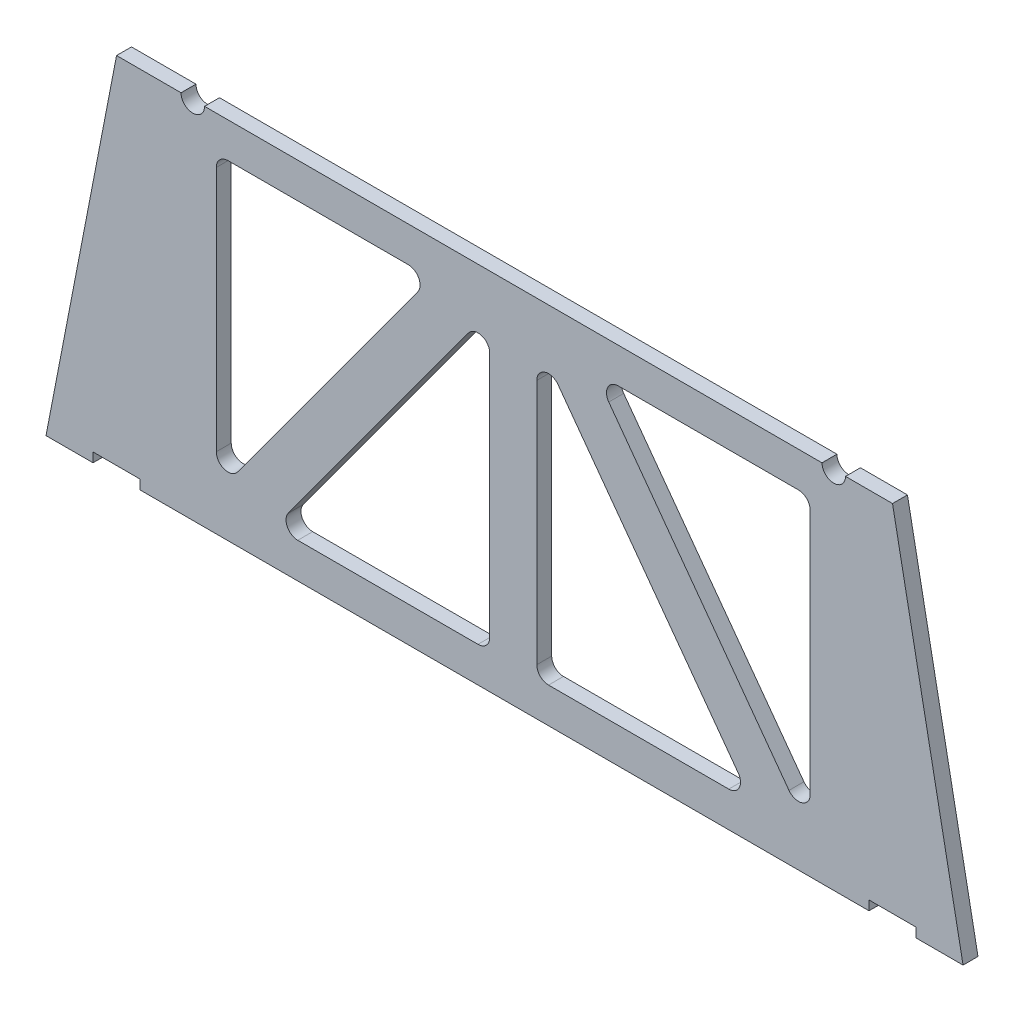
from build123d import *

# Parameters (mm, degrees)
EXTRUDE1_DEPTH = 6.35


with BuildPart() as part:
    # Sketch1 → Extrude1 (new body)
    with BuildSketch(Plane.XY):
        with BuildLine():
            Line((-158.7125, -77.5), (151.2875, -77.5))
            Line((151.2875, -77.5), (151.2875, -73.5))
            Line((151.2875, -73.5), (171.2875, -73.5))
            Line((171.2875, -73.5), (171.2875, -77.5))
            Line((171.2875, -77.5), (191.2875, -77.5))
            Line((191.2875, -77.5), (161.2875, 77.5))
            Line((161.2875, 77.5), (141.2875, 77.5))
            ThreePointArc((141.2875, 77.5), (136.2875, 72.5), (131.2875, 77.5))
            Line((131.2875, 77.5), (-131.2875, 77.5))
            ThreePointArc((-131.2875, 77.5), (-136.2875, 72.5), (-141.2875, 77.5))
            Line((-141.2875, 77.5), (-168.7125, 77.5))
            Line((-168.7125, 77.5), (-198.7125, -77.5))
            Line((-198.7125, -77.5), (-178.7125, -77.5))
            Line((-178.7125, -77.5), (-178.7125, -73.5))
            Line((-178.7125, -73.5), (-158.7125, -73.5))
            Line((-158.7125, -73.5), (-158.7125, -77.5))
        make_face()
        with BuildLine():
            Line((-126.2875, 57.5), (-126.2875, -47.204571681))
            ThreePointArc((-126.2875, -47.204571681), (-122.841073999, -51.957087628), (-117.252936868, -50.157925762))
            Line((-117.252936868, -50.157925762), (-40.607792392, 54.546645918))
            ThreePointArc((-40.607792392, 54.546645918), (-40.183276561, 59.761993545), (-44.642355524, 62.5))
            Line((-44.642355524, 62.5), (-121.2875, 62.5))
            ThreePointArc((-121.2875, 62.5), (-124.823033906, 61.035533906), (-126.2875, 57.5))
        make_face(mode=Mode.SUBTRACT)
        with BuildLine():
            Line((-95.679707608, -54.546645918), (-19.034563132, 50.157925762))
            ThreePointArc((-19.034563132, 50.157925762), (-13.446426001, 51.957087628), (-10, 47.204571681))
            Line((-10, 47.204571681), (-10, -57.5))
            ThreePointArc((-10, -57.5), (-11.464466094, -61.035533906), (-15, -62.5))
            Line((-15, -62.5), (-91.645144476, -62.5))
            ThreePointArc((-91.645144476, -62.5), (-96.104223439, -59.761993545), (-95.679707608, -54.546645918))
        make_face(mode=Mode.SUBTRACT)
        with BuildLine():
            Line((15, -62.5), (91.645144476, -62.5))
            ThreePointArc((91.645144476, -62.5), (96.104223439, -59.761993545), (95.679707608, -54.546645918))
            Line((95.679707608, -54.546645918), (19.034563132, 50.157925762))
            ThreePointArc((19.034563132, 50.157925762), (13.446426001, 51.957087628), (10, 47.204571681))
            Line((10, 47.204571681), (10, -57.5))
            ThreePointArc((10, -57.5), (11.464466094, -61.035533906), (15, -62.5))
        make_face(mode=Mode.SUBTRACT)
        with BuildLine():
            Line((44.642355524, 62.5), (121.2875, 62.5))
            ThreePointArc((121.2875, 62.5), (124.823033906, 61.035533906), (126.2875, 57.5))
            Line((126.2875, 57.5), (126.2875, -47.204571681))
            ThreePointArc((126.2875, -47.204571681), (122.841073999, -51.957087628), (117.252936868, -50.157925762))
            Line((117.252936868, -50.157925762), (40.607792392, 54.546645918))
            ThreePointArc((40.607792392, 54.546645918), (40.183276561, 59.761993545), (44.642355524, 62.5))
        make_face(mode=Mode.SUBTRACT)
    extrude(amount=EXTRUDE1_DEPTH)


solid = part.part
